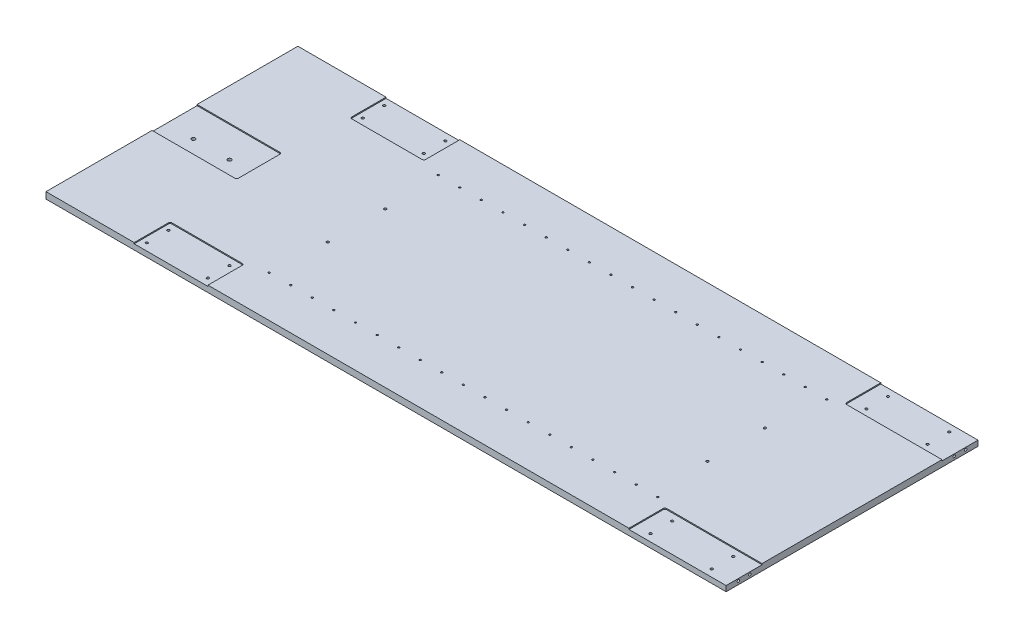
from build123d import *

# Parameters (mm, degrees)
SKETCH4_W                  = 1890
SKETCH4_H                  = 700
BOSS_EXTRUDE2_DEPTH        = 18
SKETCH5_W                  = 205
SKETCH5_H                  = 100
SKETCH5_W_2                = 270
CUT_EXTRUDE1_DEPTH         = 3
SKETCH22_W                 = 235
SKETCH22_H                 = 125
CUT_EXTRUDE2_DEPTH         = 3
M12X1_75_TAPPED_HOLE1_D    = 10.2
M8X1_25_TAPPED_HOLE1_D     = 6.8
LPATTERN1_COUNT            = 2
LPATTERN1_PITCH            = 1400
LPATTERN1_COUNT_DIR2       = 2
LPATTERN1_PITCH_DIR2       = 600
M8X1_25_TAPPED_HOLE2_D     = 6.8
M6X1_0_TAPPED_HOLE3_D      = 5
LPATTERN3_COUNT            = 19
LPATTERN3_PITCH            = 60
M8X1_25_TAPPED_HOLE3_D     = 6.8
M8X1_25_TAPPED_HOLE3_DEPTH = 22.25
M8X1_25_TAPPED_HOLE3_TIP   = 2.042926105
M8X1_25_TAPPED_HOLE4_D     = 6.8
M8X1_25_TAPPED_HOLE4_DEPTH = 22.25
M8X1_25_TAPPED_HOLE4_TIP   = 2.042926105
FILLET1_R                  = 5
FILLET2_R                  = 5


with BuildPart() as part:
    # Sketch4 → Boss-Extrude2 (new body)
    with BuildSketch(Plane(origin=(0, 0, 0), x_dir=(1, 0, 0), z_dir=(0, 1, 0))):
        with Locations((945, -350)):
            Rectangle(SKETCH4_W, SKETCH4_H)
    extrude(amount=-BOSS_EXTRUDE2_DEPTH)

    # Sketch5 → Cut-Extrude1 (cut)
    with BuildSketch(Plane(origin=(0, 0, 0), x_dir=(1, 0, 0), z_dir=(0, 1, 0))):
        with Locations((347.5, -650)):
            Rectangle(SKETCH5_W, SKETCH5_H)
        with Locations((1755, -650)):
            Rectangle(SKETCH5_W_2, SKETCH5_H)
        with Locations((1755, -50)):
            Rectangle(SKETCH5_W_2, SKETCH5_H)
        with Locations((347.5, -50)):
            Rectangle(SKETCH5_W, SKETCH5_H)
    extrude(amount=-CUT_EXTRUDE1_DEPTH, mode=Mode.SUBTRACT)

    # Sketch22 → Cut-Extrude2 (cut)
    with BuildSketch(Plane(origin=(0, 0, 0), x_dir=(1, 0, 0), z_dir=(0, 1, 0))):
        with Locations((117.5, -342.75)):
            Rectangle(SKETCH22_W, SKETCH22_H)
    extrude(amount=-CUT_EXTRUDE2_DEPTH, mode=Mode.SUBTRACT)

    # M12x1.75 Tapped Hole1 (through all)
    with Locations(Plane(origin=(-24.038411421, -3, -27.656523822), x_dir=(-1, 0, 0), z_dir=(0, 1, 0))):
        with Locations((-99.038411421, 392.956523822), (-199.038411421, 392.956523822)):
            Hole(M12X1_75_TAPPED_HOLE1_D / 2)

    # M8x1.25 Tapped Hole1 (through all)
    with Locations(Plane(origin=(0, -3, 0), x_dir=(-1, 0, 0), z_dir=(0, 1, 0))):
        with Locations((-260, 80), (-260, 20), (-430, 20), (-430, 80)):
            m8x1_25_tapped_hole1 = Hole(M8X1_25_TAPPED_HOLE1_D / 2)

    # LPattern1: M8x1.25 Tapped Hole1 2 × 2
    with Locations(*[(i * LPATTERN1_PITCH, 0, j * LPATTERN1_PITCH_DIR2) for i in range(LPATTERN1_COUNT) for j in range(LPATTERN1_COUNT_DIR2) if (i, j) != (0, 0)]):
        add(m8x1_25_tapped_hole1, mode=Mode.SUBTRACT)

    # M8x1.25 Tapped Hole2 (through all)
    with Locations(Plane(origin=(0, 0, 0), x_dir=(-1, 0, 0), z_dir=(0, 1, 0))):
        with Locations((-513, 270), (-513, 430), (-1568, 270), (-1568, 430)):
            Hole(M8X1_25_TAPPED_HOLE2_D / 2)

    # M6x1.0 Tapped Hole3 (through all)
    with Locations(Plane(origin=(0, 0, 0), x_dir=(-1, 0, 0), z_dir=(0, 1, 0))):
        with Locations((-505, 115), (-505, 585)):
            m6x1_0_tapped_hole3 = Hole(M6X1_0_TAPPED_HOLE3_D / 2)

    # LPattern3: M6x1.0 Tapped Hole3 ×19
    with Locations(*[(i * LPATTERN3_PITCH, 0, 0) for i in range(1, LPATTERN3_COUNT)]):
        add(m6x1_0_tapped_hole3, mode=Mode.SUBTRACT)

    # M8x1.25 Tapped Hole3
    with Locations(Plane(origin=(1890, 0, 0), x_dir=(0, 0, -1), z_dir=(1, 0, 0))):
        with Locations((-66, -9), (-666, -9), (-634, -9), (-34, -9)):
            Hole(M8X1_25_TAPPED_HOLE3_D / 2, depth=M8X1_25_TAPPED_HOLE3_DEPTH)
            with Locations((0, 0, -(M8X1_25_TAPPED_HOLE3_DEPTH + M8X1_25_TAPPED_HOLE3_TIP / 2))):  # 118° drill point
                Cone(0, M8X1_25_TAPPED_HOLE3_D / 2, M8X1_25_TAPPED_HOLE3_TIP, mode=Mode.SUBTRACT)

    # M8x1.25 Tapped Hole4
    with Locations(Plane.ZY):
        with Locations((319.25, -9), (351.25, -9)):
            Hole(M8X1_25_TAPPED_HOLE4_D / 2, depth=M8X1_25_TAPPED_HOLE4_DEPTH)
            with Locations((0, 0, -(M8X1_25_TAPPED_HOLE4_DEPTH + M8X1_25_TAPPED_HOLE4_TIP / 2))):  # 118° drill point
                Cone(0, M8X1_25_TAPPED_HOLE4_D / 2, M8X1_25_TAPPED_HOLE4_TIP, mode=Mode.SUBTRACT)

    # Fillet1
    fillet1_edges = [part.edges().sort_by_distance(p)[0] for p in [
        (245, -1.5, 600),
        (450, -1.5, 600),
        (1620, -1.5, 600),
        (1620, -1.5, 100),
        (245, -1.5, 100),
        (450, -1.5, 100),
    ]]
    fillet(fillet1_edges, radius=FILLET1_R)

    # Fillet2
    fillet2_edges = [part.edges().sort_by_distance(p)[0] for p in [
        (235, -1.5, 280.25),
        (235, -1.5, 405.25),
    ]]
    fillet(fillet2_edges, radius=FILLET2_R)


solid = part.part
